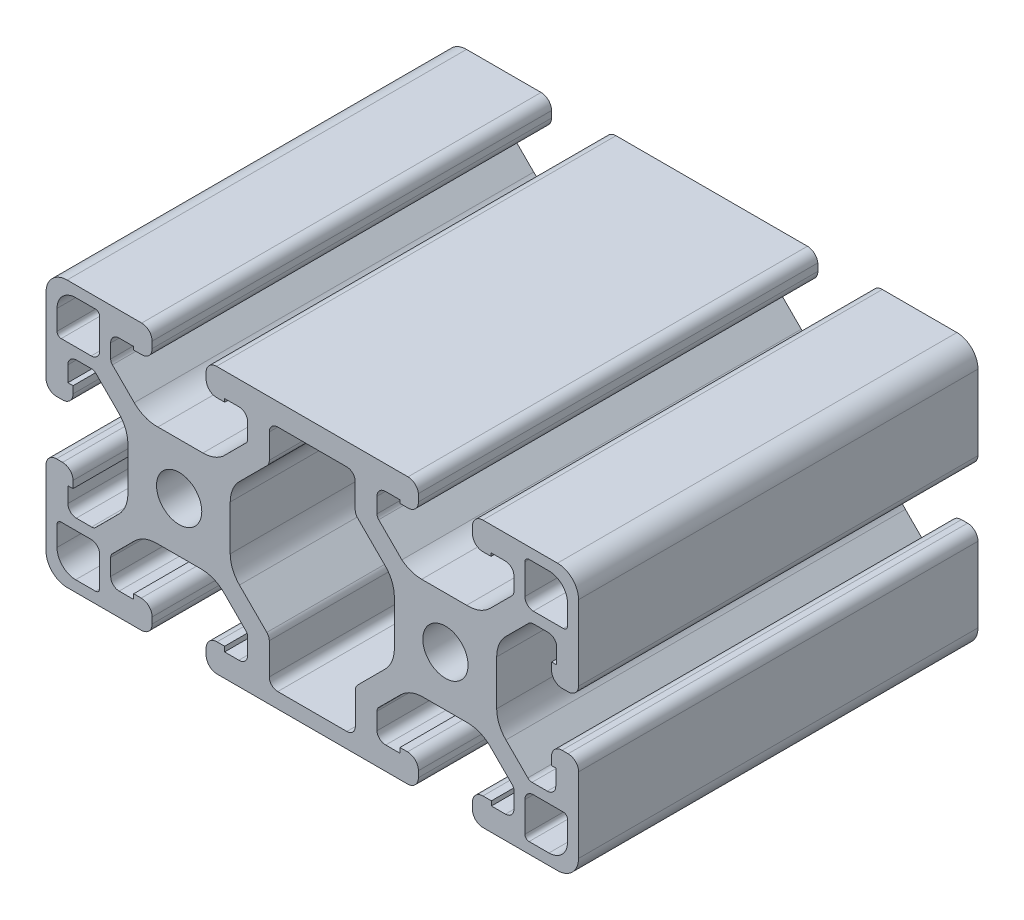
from build123d import *

# Parameters (mm, degrees)
SKETCH1_R      = 3.4
EXTRUDE1_DEPTH = 60


with BuildPart() as part:
    # Sketch1 → Extrude1 (new body)
    with BuildSketch(Plane.XY):
        with BuildLine():
            Line((-34.38, 20), (-5.62, 20))
            ThreePointArc((-5.62, 20), (-4.574261351, 19.60103829), (-4.06, 18.60691806))
            Line((-4.06, 18.60691806), (-4.06, 17.51))
            ThreePointArc((-4.06, 17.51), (-4.519842354, 16.399842354), (-5.63, 15.94))
            Line((-5.63, 15.94), (-6.848295327, 15.94))
            Line((-6.848295327, 15.94), (-6.848295327, 16.411729227))
            Line((-6.848295327, 16.411729227), (-8.956262543, 16.411729227))
            ThreePointArc((-8.956262543, 16.411729227), (-9.89201295, 16.061645977), (-10.285, 15.143088257))
            Line((-10.285, 15.143088257), (-10.285, 12.847645092))
            ThreePointArc((-10.285, 12.847645092), (-10.217146583, 12.506800558), (-10.023932594, 12.217927859))
            Line((-10.023932594, 12.217927859), (-6.541366663, 8.739701268))
            ThreePointArc((-6.541366663, 8.739701268), (-5.14376203, 7.966343661), (-3.568820203, 7.7))
            Line((-3.568820203, 7.7), (3.18718254, 7.7))
            ThreePointArc((3.18718254, 7.7), (5.111909818, 8.02014308), (6.745550907, 9.087046766))
            Line((6.745550907, 9.087046766), (10.024325035, 12.365820894))
            ThreePointArc((10.024325035, 12.365820894), (10.217252784, 12.654557674), (10.285, 12.995145929))
            Line((10.285, 12.995145929), (10.285, 15.086937017))
            ThreePointArc((10.285, 15.086937017), (9.913025612, 15.984962629), (9.015, 16.356937017))
            Line((9.015, 16.356937017), (6.848295327, 16.356937017))
            Line((6.848295327, 16.356937017), (6.848295327, 15.88520779))
            Line((6.848295327, 15.88520779), (5.63, 15.88520779))
            ThreePointArc((5.63, 15.88520779), (4.519842354, 16.345050144), (4.06, 17.45520779))
            Line((4.06, 17.45520779), (4.06, 18.43))
            ThreePointArc((4.06, 18.43), (4.519842354, 19.540157646), (5.63, 20))
            Line((5.63, 20), (14.281820422, 20))
            Line((14.281820422, 20), (16.83, 20))
            ThreePointArc((16.83, 20), (19.071528496, 19.071528496), (20, 16.83))
            Line((20, 16.83), (20, 13))
            Line((20, 13), (20, 5.571883806))
            ThreePointArc((20, 5.571883806), (19.520492841, 4.499481643), (18.431075989, 4.059999631))
            Line((18.431075989, 4.059999631), (17.51, 4.059999631))
            ThreePointArc((17.51, 4.059999631), (16.399842354, 4.519841985), (15.94, 5.629999631))
            Line((15.94, 5.629999631), (15.94, 6.696409732))
            Line((15.94, 6.696409732), (16.715022223, 6.696409732))
            Line((16.715022223, 6.696409732), (16.715022223, 9.02))
            ThreePointArc((16.715022223, 9.02), (16.343047835, 9.918025612), (15.445022223, 10.29))
            Line((15.445022223, 10.29), (13.15011805, 10.29))
            ThreePointArc((13.15011805, 10.29), (12.809529795, 10.222252784), (12.520793015, 10.029325035))
            Line((12.520793015, 10.029325035), (9.091242789, 6.59977481))
            ThreePointArc((9.091242789, 6.59977481), (8.061572221, 5.058763903), (7.7, 3.241017599))
            Line((7.7, 3.241017599), (7.7, -3.514985144))
            ThreePointArc((7.7, -3.514985144), (8.061005845, -5.331363493), (9.089149602, -6.871647862))
            Line((9.089149602, -6.871647862), (12.377834665, -10.164435797))
            ThreePointArc((12.377834665, -10.164435797), (12.666707364, -10.357649787), (13.007551897, -10.425503204))
            Line((13.007551897, -10.425503204), (15.30245607, -10.425503204))
            ThreePointArc((15.30245607, -10.425503204), (16.200481682, -10.053528816), (16.57245607, -9.155503204))
            Line((16.57245607, -9.155503204), (16.57245607, -6.779901474))
            Line((16.57245607, -6.779901474), (15.94, -6.779901474))
            Line((15.94, -6.779901474), (15.94, -5.569550674))
            ThreePointArc((15.94, -5.569550674), (16.399842354, -4.459393028), (17.51, -3.999550674))
            Line((17.51, -3.999550674), (18.43, -3.999550674))
            ThreePointArc((18.43, -3.999550674), (19.540157646, -4.459393028), (20, -5.569550674))
            Line((20, -5.569550674), (20, -16.83))
            ThreePointArc((20, -16.83), (19.071528496, -19.071528496), (16.83, -20))
            Line((16.83, -20), (14.322274694, -20))
            Line((14.322274694, -20), (5.694366927, -20))
            ThreePointArc((5.694366927, -20), (4.542837301, -19.564006433), (4.059999445, -18.431320037))
            Line((4.059999445, -18.431320037), (4.059999445, -17.45520779))
            ThreePointArc((4.059999445, -17.45520779), (4.519841799, -16.345050144), (5.629999445, -15.88520779))
            Line((5.629999445, -15.88520779), (6.907032762, -15.88520779))
            Line((6.907032762, -15.88520779), (6.907032762, -16.558380889))
            Line((6.907032762, -16.558380889), (9.015, -16.558380889))
            ThreePointArc((9.015, -16.558380889), (9.913025612, -16.186406501), (10.285, -15.288380889))
            Line((10.285, -15.288380889), (10.285, -12.829086847))
            ThreePointArc((10.285, -12.829086847), (10.217252784, -12.488498592), (10.024325035, -12.199761812))
            Line((10.024325035, -12.199761812), (6.739188515, -8.914625291))
            ThreePointArc((6.739188515, -8.914625291), (5.199545386, -7.885521524), (3.383392441, -7.523383425))
            Line((3.383392441, -7.523383425), (-3.380431304, -7.523383425))
            ThreePointArc((-3.380431304, -7.523383425), (-5.198177608, -7.884955645), (-6.739188515, -8.914626214))
            Line((-6.739188515, -8.914626214), (-10.024325035, -12.199762735))
            ThreePointArc((-10.024325035, -12.199762735), (-10.217252784, -12.488499515), (-10.285, -12.82908777))
            Line((-10.285, -12.82908777), (-10.285, -15.368632999))
            ThreePointArc((-10.285, -15.368632999), (-9.869779979, -16.230781197), (-8.970677639, -16.558381812))
            Line((-8.970677639, -16.558381812), (-6.828250761, -16.558381812))
            Line((-6.828250761, -16.558381812), (-6.828250761, -15.813027771))
            Line((-6.828250761, -15.813027771), (-5.694367402, -15.813027771))
            ThreePointArc((-5.694367402, -15.813027771), (-4.538695129, -16.2917229), (-4.06, -17.447395173))
            Line((-4.06, -17.447395173), (-4.06, -18.365632122))
            ThreePointArc((-4.06, -18.365632122), (-4.538694961, -19.521304703), (-5.694367402, -20))
            Line((-5.694367402, -20), (-13.060449326, -20))
            Line((-13.060449326, -20), (-26.939550674, -20))
            Line((-26.939550674, -20), (-34.305633073, -20))
            ThreePointArc((-34.305633073, -20), (-35.461305039, -19.521304703), (-35.94, -18.365632598))
            Line((-35.94, -18.365632598), (-35.94, -17.447395173))
            ThreePointArc((-35.94, -17.447395173), (-35.461304871, -16.2917229), (-34.305632598, -15.813027771))
            Line((-34.305632598, -15.813027771), (-33.171749239, -15.813027771))
            Line((-33.171749239, -15.813027771), (-33.171749239, -16.558380889))
            Line((-33.171749239, -16.558380889), (-31.029322361, -16.558380889))
            ThreePointArc((-31.029322361, -16.558380889), (-30.130220021, -16.230780274), (-29.715, -15.368632076))
            Line((-29.715, -15.368632076), (-29.715, -12.829086847))
            ThreePointArc((-29.715, -12.829086847), (-29.782747216, -12.488498592), (-29.975674965, -12.199761812))
            Line((-29.975674965, -12.199761812), (-33.260811485, -8.914625291))
            ThreePointArc((-33.260811485, -8.914625291), (-34.801822392, -7.884954722), (-36.619568696, -7.523382502))
            Line((-36.619568696, -7.523382502), (-43.380431304, -7.523382502))
            ThreePointArc((-43.380431304, -7.523382502), (-45.198177608, -7.884954722), (-46.739188515, -8.914625291))
            Line((-46.739188515, -8.914625291), (-50.024325035, -12.199761812))
            ThreePointArc((-50.024325035, -12.199761812), (-50.217252784, -12.488498592), (-50.285, -12.829086847))
            Line((-50.285, -12.829086847), (-50.285, -15.288380889))
            ThreePointArc((-50.285, -15.288380889), (-49.913025612, -16.186406501), (-49.015, -16.558380889))
            Line((-49.015, -16.558380889), (-46.828250761, -16.558380889))
            Line((-46.828250761, -16.558380889), (-46.828250761, -15.813027771))
            Line((-46.828250761, -15.813027771), (-45.694367402, -15.813027771))
            ThreePointArc((-45.694367402, -15.813027771), (-44.538695129, -16.2917229), (-44.06, -17.447395173))
            Line((-44.06, -17.447395173), (-44.06, -18.365632598))
            ThreePointArc((-44.06, -18.365632598), (-44.538694961, -19.521304703), (-45.694366927, -20))
            Line((-45.694366927, -20), (-56.83, -20))
            ThreePointArc((-56.83, -20), (-59.071528496, -19.071528496), (-60, -16.83))
            Line((-60, -16.83), (-60, -5.571883806))
            ThreePointArc((-60, -5.571883806), (-59.520492841, -4.499481643), (-58.431075989, -4.059999631))
            Line((-58.431075989, -4.059999631), (-57.51, -4.06))
            ThreePointArc((-57.51, -4.06), (-56.399842354, -4.519842354), (-55.94, -5.63))
            Line((-55.94, -5.63), (-55.94, -6.696410101))
            Line((-55.94, -6.696410101), (-56.715022223, -6.696410101))
            Line((-56.715022223, -6.696410101), (-56.715022223, -9.02))
            ThreePointArc((-56.715022223, -9.02), (-56.343047835, -9.918025612), (-55.445022223, -10.29))
            Line((-55.445022223, -10.29), (-53.15011805, -10.29))
            ThreePointArc((-53.15011805, -10.29), (-52.809529795, -10.222252784), (-52.520793015, -10.029325035))
            Line((-52.520793015, -10.029325035), (-49.091242789, -6.59977481))
            ThreePointArc((-49.091242789, -6.59977481), (-48.061572221, -5.058763903), (-47.7, -3.241017599))
            Line((-47.7, -3.241017599), (-47.7, 3.241017599))
            ThreePointArc((-47.7, 3.241017599), (-48.061572221, 5.058763903), (-49.091242789, 6.59977481))
            Line((-49.091242789, 6.59977481), (-52.520793015, 10.029325035))
            ThreePointArc((-52.520793015, 10.029325035), (-52.809529795, 10.222252784), (-53.15011805, 10.29))
            Line((-53.15011805, 10.29), (-55.445022223, 10.29))
            ThreePointArc((-55.445022223, 10.29), (-56.343047835, 9.918025612), (-56.715022223, 9.02))
            Line((-56.715022223, 9.02), (-56.715022223, 6.696410101))
            Line((-56.715022223, 6.696410101), (-55.94, 6.696410101))
            Line((-55.94, 6.696410101), (-55.94, 5.63))
            ThreePointArc((-55.94, 5.63), (-56.399842354, 4.519842354), (-57.51, 4.06))
            Line((-57.51, 4.06), (-58.431075989, 4.059999631))
            ThreePointArc((-58.431075989, 4.059999631), (-59.520492841, 4.499481643), (-60, 5.571883806))
            Line((-60, 5.571883806), (-60, 13))
            Line((-60, 13), (-60, 16.83))
            ThreePointArc((-60, 16.83), (-59.071528496, 19.071528496), (-56.83, 20))
            Line((-56.83, 20), (-45.63, 20))
            ThreePointArc((-45.63, 20), (-44.519842354, 19.540157646), (-44.06, 18.43))
            Line((-44.06, 18.43), (-44.06, 17.45520779))
            ThreePointArc((-44.06, 17.45520779), (-44.519842354, 16.345050144), (-45.63, 15.88520779))
            Line((-45.63, 15.88520779), (-46.848295327, 15.88520779))
            Line((-46.848295327, 15.88520779), (-46.848295327, 16.356937017))
            Line((-46.848295327, 16.356937017), (-49.015, 16.356937017))
            ThreePointArc((-49.015, 16.356937017), (-49.913025612, 15.984962629), (-50.285, 15.086937017))
            Line((-50.285, 15.086937017), (-50.285, 12.995145929))
            ThreePointArc((-50.285, 12.995145929), (-50.217252784, 12.654557674), (-50.024325035, 12.365820894))
            Line((-50.024325035, 12.365820894), (-46.745550907, 9.087046766))
            ThreePointArc((-46.745550907, 9.087046766), (-45.111909818, 8.02014308), (-43.18718254, 7.7))
            Line((-43.18718254, 7.7), (-36.42447528, 7.7))
            ThreePointArc((-36.42447528, 7.7), (-34.853074074, 7.967456275), (-33.458633337, 8.739706))
            Line((-33.458633337, 8.739706), (-29.976067406, 12.217932591))
            ThreePointArc((-29.976067406, 12.217932591), (-29.782853417, 12.50680529), (-29.715, 12.847649823))
            Line((-29.715, 12.847649823), (-29.715, 15.143088257))
            ThreePointArc((-29.715, 15.143088257), (-30.107987042, 16.061645969), (-31.043737435, 16.411729227))
            Line((-31.043737435, 16.411729227), (-33.151704673, 16.411729227))
            Line((-33.151704673, 16.411729227), (-33.151704673, 15.94))
            Line((-33.151704673, 15.94), (-34.37, 15.94))
            ThreePointArc((-34.37, 15.94), (-35.480157646, 16.399842354), (-35.94, 17.51))
            Line((-35.94, 17.51), (-35.94, 18.60691806))
            ThreePointArc((-35.94, 18.60691806), (-35.425738649, 19.60103829), (-34.38, 20))
        make_face()
        with Locations((-40, 0)):
            Circle(SKETCH1_R, mode=Mode.SUBTRACT)
        with Locations(Location((0, 0, 0), (0, 0, 180))):
            Circle(SKETCH1_R, mode=Mode.SUBTRACT)
        with BuildLine():
            Line((-30.939717555, -6.735226492), (-26.832379884, -10.842564163))
            ThreePointArc((-26.832379884, -10.842564163), (-26.55707849, -11.254581816), (-26.460405496, -11.740589775))
            Line((-26.460405496, -11.740589775), (-26.460405496, -16.447436081))
            ThreePointArc((-26.460405496, -16.447436081), (-26.088431108, -17.345461693), (-25.190405496, -17.717436081))
            Line((-25.190405496, -17.717436081), (-14.809594504, -17.717436081))
            ThreePointArc((-14.809594504, -17.717436081), (-13.911568892, -17.345461693), (-13.539594504, -16.447436081))
            Line((-13.539594504, -16.447436081), (-13.539594504, -11.740589775))
            ThreePointArc((-13.539594504, -11.740589775), (-13.442921131, -11.254581958), (-13.167619463, -10.842564566))
            Line((-13.167619463, -10.842564566), (-9.062375632, -6.737320735))
            ThreePointArc((-9.062375632, -6.737320735), (-8.032138688, -5.194941873), (-7.671133766, -3.375602388))
            Line((-7.671133766, -3.375602388), (-7.675346726, 3.3824627))
            ThreePointArc((-7.675346726, 3.3824627), (-8.038052054, 5.199983248), (-9.068683085, 6.740351962))
            Line((-9.068683085, 6.740351962), (-13.17858046, 10.845128331))
            ThreePointArc((-13.17858046, 10.845128331), (-13.453881854, 11.257145984), (-13.550554848, 11.743153943))
            Line((-13.550554848, 11.743153943), (-13.550554848, 15.430000252))
            ThreePointArc((-13.550554848, 15.430000252), (-13.922527865, 16.328024493), (-14.820550972, 16.700000252))
            Line((-14.820550972, 16.700000252), (-20.000001006, 16.696771398))
            Line((-20.000001006, 16.696771398), (-25.178653438, 16.699999756))
            ThreePointArc((-25.178653438, 16.699999756), (-26.077190808, 16.328305483), (-26.449445152, 15.43))
            Line((-26.449445152, 15.43), (-26.449445152, 11.743153694))
            ThreePointArc((-26.449445152, 11.743153694), (-26.546118146, 11.257145735), (-26.82141954, 10.845128082))
            Line((-26.82141954, 10.845128082), (-30.931316915, 6.740351712))
            ThreePointArc((-30.931316915, 6.740351712), (-31.961947946, 5.199982999), (-32.324653274, 3.382462451))
            Line((-32.324653274, 3.382462451), (-32.328866234, -3.375602637))
            ThreePointArc((-32.328866234, -3.375602637), (-31.968427261, -5.193573991), (-30.939717555, -6.735226492))
        make_face(mode=Mode.SUBTRACT)
        with BuildLine():
            Line((-57.72, 11.94), (-53.21, 11.94))
            ThreePointArc((-53.21, 11.94), (-52.308743898, 12.310198515), (-51.935, 13.209990157))
            Line((-51.935, 13.209990157), (-51.935, 17.72))
            ThreePointArc((-51.935, 17.72), (-52.119522728, 18.165477272), (-52.565, 18.35))
            Line((-52.565, 18.35), (-55.545, 18.35))
            ThreePointArc((-55.545, 18.35), (-57.524898987, 17.529898987), (-58.345, 15.55))
            Line((-58.345, 15.55), (-58.345, 12.569980158))
            ThreePointArc((-58.345, 12.569980158), (-58.162241545, 12.126274175), (-57.72, 11.94))
        make_face(mode=Mode.SUBTRACT)
        with BuildLine():
            Line((-51.935, -17.72), (-51.935, -13.209990157))
            ThreePointArc((-51.935, -13.209990157), (-52.308743898, -12.310198515), (-53.21, -11.94))
            Line((-53.21, -11.94), (-57.72, -11.94))
            ThreePointArc((-57.72, -11.94), (-58.162241545, -12.126274175), (-58.345, -12.569980158))
            Line((-58.345, -12.569980158), (-58.345, -15.55))
            ThreePointArc((-58.345, -15.55), (-57.524898987, -17.529898987), (-55.545, -18.35))
            Line((-55.545, -18.35), (-52.565, -18.35))
            ThreePointArc((-52.565, -18.35), (-52.119522728, -18.165477272), (-51.935, -17.72))
        make_face(mode=Mode.SUBTRACT)
        with BuildLine():
            Line((18.345, -15.55), (18.345, -12.57))
            ThreePointArc((18.345, -12.57), (18.162248533, -12.126281217), (17.72, -11.94))
            Line((17.72, -11.94), (13.21, -11.94))
            ThreePointArc((13.21, -11.94), (12.308743898, -12.310198515), (11.935, -13.209990157))
            Line((11.935, -13.209990157), (11.935, -17.72))
            ThreePointArc((11.935, -17.72), (12.119522728, -18.165477272), (12.565, -18.35))
            Line((12.565, -18.35), (15.545, -18.35))
            ThreePointArc((15.545, -18.35), (17.524898987, -17.529898987), (18.345, -15.55))
        make_face(mode=Mode.SUBTRACT)
        with BuildLine():
            Line((18.345, 15.55), (18.345, 12.57))
            ThreePointArc((18.345, 12.57), (18.162248533, 12.126281217), (17.72, 11.94))
            Line((17.72, 11.94), (13.21, 11.94))
            ThreePointArc((13.21, 11.94), (12.308743898, 12.310198515), (11.935, 13.209990157))
            Line((11.935, 13.209990157), (11.935, 17.72))
            ThreePointArc((11.935, 17.72), (12.119522728, 18.165477272), (12.565, 18.35))
            Line((12.565, 18.35), (15.545, 18.35))
            ThreePointArc((15.545, 18.35), (17.524898987, 17.529898987), (18.345, 15.55))
        make_face(mode=Mode.SUBTRACT)
    extrude(amount=-EXTRUDE1_DEPTH)


solid = part.part
